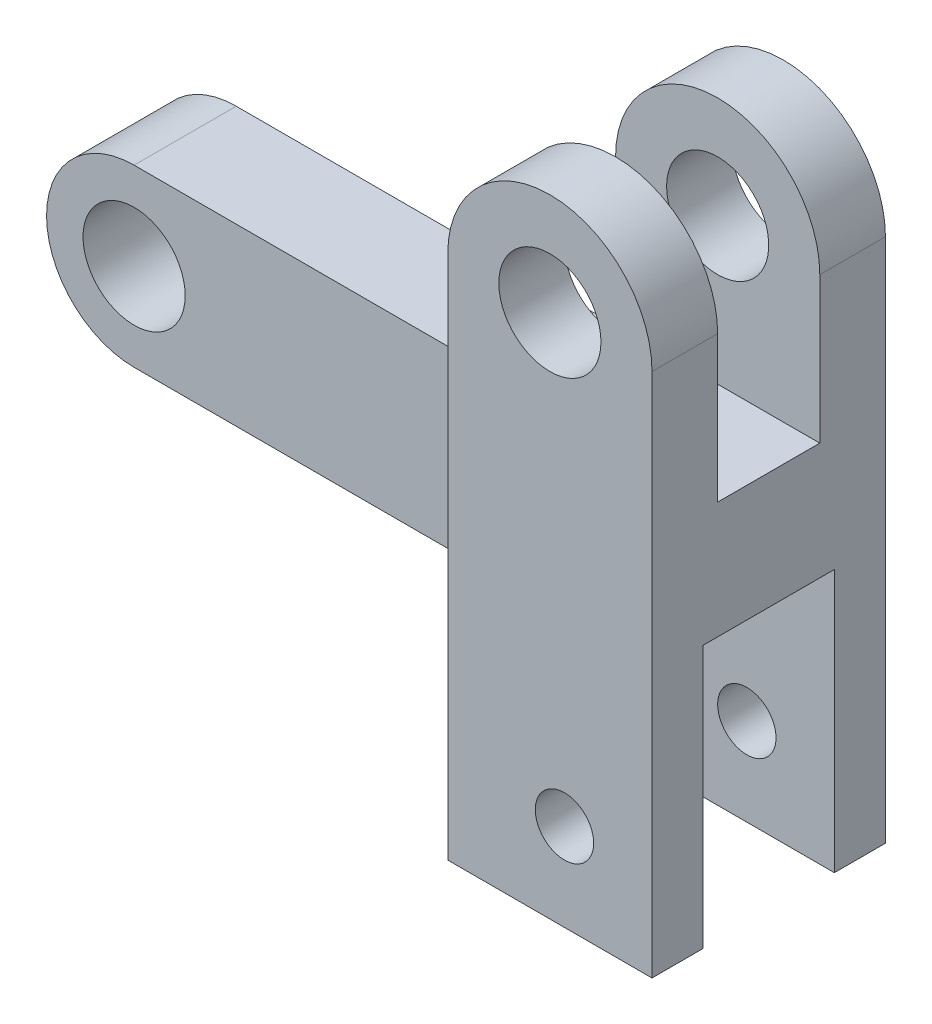
from build123d import *
from build123d.topology import SkipClean

# Parameters (mm, degrees)
SKETCH_1_W          = 7
SKETCH_1_H          = 7
EXTRUDE_1_DEPTH     = 2.4
EXTRUDE_6_DEPTH     = 1.75
EXTRUDE_START       = -5.25
EXTRUDE_8_DEPTH     = 1.75
SKETCH_11_R         = 1.75
CUT_EXTRUDE_1_DEPTH = 17.740669043
SKETCH_17_W         = 7
SKETCH_17_H         = 7
EXTRUDE_10_DEPTH    = 8
SKETCH_15_R         = 1.75
EXTRUDE_9_DEPTH     = 1.75
SKETCH_12_R         = 1
CUT_EXTRUDE_2_DEPTH = 22.1896201
SKETCH_18_W         = 7
SKETCH_18_H         = 4.5
CUT_EXTRUDE_4_DEPTH = 9
SKETCH_19_R         = 1
SKETCH_19_R_2       = 1.75
EXTRUDE_11_DEPTH    = 0.5
EXTRUDE_START_2     = 0.5
SKETCH_20_R         = 1
SKETCH_20_R_2       = 1.75
EXTRUDE_12_DEPTH    = 0.5


with BuildPart() as part:
    # 草图1 → 凸台-拉伸1 (new body)
    with BuildSketch(Plane(origin=(0, 0, 0), x_dir=(1, 0, 0), z_dir=(0, 1, 0))):
        with Locations((3.5, 0)):
            Rectangle(SKETCH_1_W, SKETCH_1_H)
    extrude(amount=EXTRUDE_1_DEPTH)

    # 草图10 → 凸台-拉伸6 (add)
    with BuildSketch(Plane(origin=(0, 0, -3.5), x_dir=(-1, 0, 0), z_dir=(0, 0, -1))):
        with BuildLine():
            Line((-7, 10), (-7, 2.4))
            Line((-7, 2.4), (0, 2.4))
            Line((0, 2.4), (0, 10))
            ThreePointArc((0, 10), (-3.5, 13.5), (-7, 10))
        make_face()
    extrude(amount=-EXTRUDE_6_DEPTH)

    # 草图10<2> → 凸台-拉伸8 (add)
    with BuildSketch(Plane(origin=(0, 0, -3.5), x_dir=(-1, 0, 0), z_dir=(0, 0, -1)).offset(EXTRUDE_START)):
        with BuildLine():
            Line((-7, 10), (-7, 2.4))
            Line((-7, 2.4), (0, 2.4))
            Line((0, 2.4), (0, 10))
            ThreePointArc((0, 10), (-3.5, 13.5), (-7, 10))
        make_face()
    extrude(amount=-EXTRUDE_8_DEPTH)

    # 草图11 → 切除-拉伸1 (cut, through all)
    with BuildSketch(Plane(origin=(0, 0, -3.5), x_dir=(-1, 0, 0), z_dir=(0, 0, -1))):
        with Locations((-3.5, 10)):
            Circle(SKETCH_11_R)
    extrude(amount=-CUT_EXTRUDE_1_DEPTH, mode=Mode.SUBTRACT)

    # 草图17 → 凸台-拉伸10 (add)
    with BuildSketch(Plane.XZ):
        with Locations((3.5, 0)):
            Rectangle(SKETCH_17_W, SKETCH_17_H)
    extrude(amount=EXTRUDE_10_DEPTH)

    # 草图15 → 凸台-拉伸9 (add, symmetric)
    with BuildSketch(Plane.XY):
        with BuildLine():
            Line((7, 2.4), (7, 5))
            Line((7, 5), (-13, 5))
            ThreePointArc((-13, 5), (-16, 2), (-13, -1))
            Line((-13, -1), (7, -1))
            Line((7, -1), (7, 2.4))
        make_face()
        with Locations((-13, 2)):
            Circle(SKETCH_15_R, mode=Mode.SUBTRACT)
    extrude(amount=EXTRUDE_9_DEPTH, both=True)

    # 草图12 → 切除-拉伸2 (cut, through all)
    with BuildSketch(Plane(origin=(0, 4, 3.5), x_dir=(1, 0, 0), z_dir=(0, 0, -1))):
        with Locations((4, 9)):
            Circle(SKETCH_12_R)
    extrude(amount=CUT_EXTRUDE_2_DEPTH, mode=Mode.SUBTRACT)

    # 草图18 → 切除-拉伸4 (cut)
    with BuildSketch(Plane(origin=(7.4, -8, 0), x_dir=(1, 0, 0), z_dir=(0, 1, 0))):
        with Locations((-3.9, 0)):
            Rectangle(SKETCH_18_W, SKETCH_18_H)
    extrude(amount=CUT_EXTRUDE_4_DEPTH, mode=Mode.SUBTRACT)

    # 草图19 → 凸台-拉伸11 (add)
    with SkipClean():  # the faces are left unmerged after this step: merging them gives an invalid solid
        with BuildSketch(Plane.XY.offset(3.5)):
            with BuildLine():
                Line((0, 10), (0, -8))
                Line((0, -8), (7, -8))
                Line((7, -8), (7, 10))
                ThreePointArc((7, 10), (3.5, 13.5), (0, 10))
            make_face()
            with Locations((4, -5)):
                Circle(SKETCH_19_R, mode=Mode.SUBTRACT)
            with Locations((3.5, 10)):
                Circle(SKETCH_19_R_2, mode=Mode.SUBTRACT)
        extrude(amount=EXTRUDE_11_DEPTH)

    # 草图20 → 凸台-拉伸12 (add)
    with SkipClean():  # the faces are left unmerged after this step: merging them gives an invalid solid
        with BuildSketch(Plane(origin=(0, 0, -3.5), x_dir=(-1, 0, 0), z_dir=(0, 0, -1)).offset(EXTRUDE_START_2)):
            with BuildLine():
                Line((-7, 10), (-7, -8))
                Line((-7, -8), (0, -8))
                Line((0, -8), (0, 10))
                ThreePointArc((0, 10), (-3.5, 13.5), (-7, 10))
            make_face()
            with Locations((-4, -5)):
                Circle(SKETCH_20_R, mode=Mode.SUBTRACT)
            with Locations((-3.5, 10)):
                Circle(SKETCH_20_R_2, mode=Mode.SUBTRACT)
        extrude(amount=-EXTRUDE_12_DEPTH)


solid = part.part
